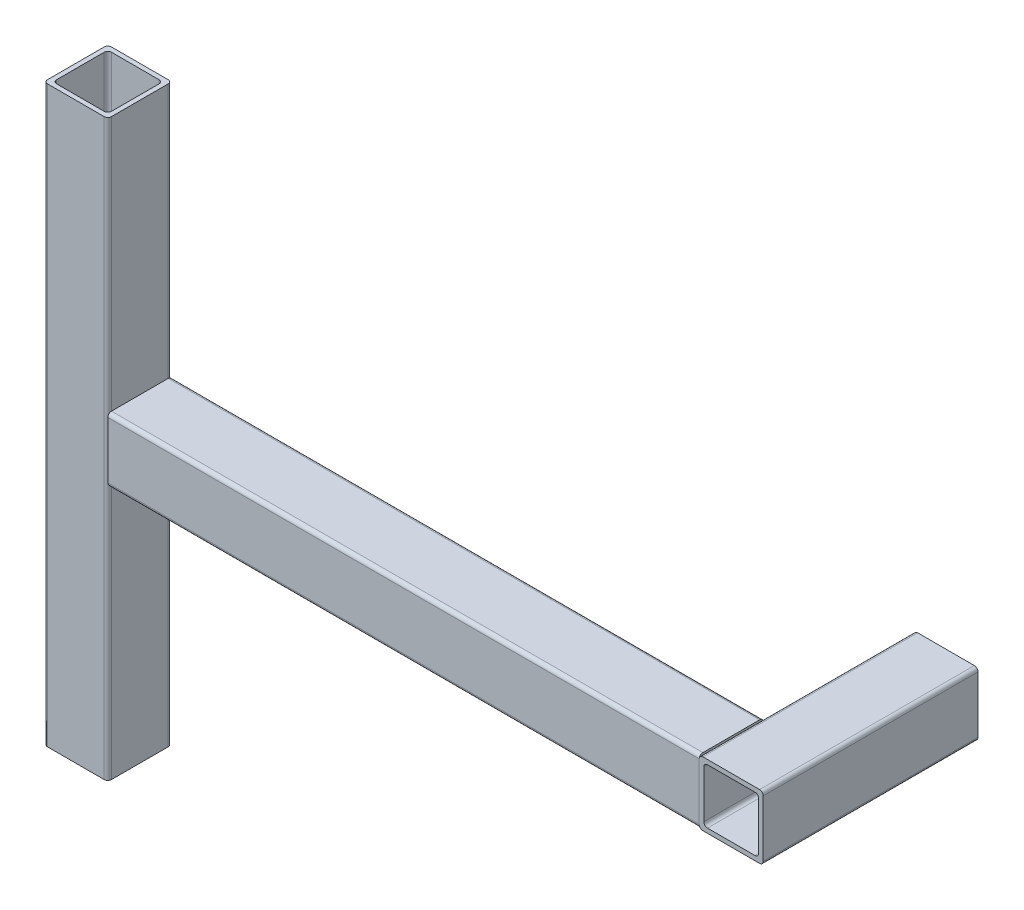
from build123d import *

# Parameters (mm, degrees)
CUSTOM_TUBE_CARRE_35_2_5_1_DEPTH   = 117.5
CUSTOM_TUBE_CARRE_35_2_5_1_2_DEPTH = 360.55
CUSTOM_TUBE_CARRE_35_2_5_1_3_DEPTH = 314.11


with BuildPart() as part:
    # Esquisse1 → Custom TUBE-CARRE-35-2.5(1) (new body)
    with BuildSketch(Plane.XY):
        with BuildLine():
            Line((-15.5, -17.5), (15.5, -17.5))
            ThreePointArc((15.5, -17.5), (16.914213562, -16.914213562), (17.5, -15.5))
            Line((17.5, -15.5), (17.5, 15.5))
            ThreePointArc((17.5, 15.5), (16.914213562, 16.914213562), (15.5, 17.5))
            Line((15.5, 17.5), (-15.5, 17.5))
            ThreePointArc((-15.5, 17.5), (-16.914213562, 16.914213562), (-17.5, 15.5))
            Line((-17.5, 15.5), (-17.5, -15.5))
            ThreePointArc((-17.5, -15.5), (-16.914213562, -16.914213562), (-15.5, -17.5))
        make_face()
        with BuildLine():
            Line((-13, -15), (13, -15))
            ThreePointArc((13, -15), (14.414213562, -14.414213562), (15, -13))
            Line((15, -13), (15, 13))
            ThreePointArc((15, 13), (14.414213562, 14.414213562), (13, 15))
            Line((13, 15), (-13, 15))
            ThreePointArc((-13, 15), (-14.414213562, 14.414213562), (-15, 13))
            Line((-15, 13), (-15, -13))
            ThreePointArc((-15, -13), (-14.414213562, -14.414213562), (-13, -15))
        make_face(mode=Mode.SUBTRACT)
    extrude(amount=CUSTOM_TUBE_CARRE_35_2_5_1_DEPTH)


with BuildPart() as body_2:
    # Esquisse1 on segment 2 (carried to segment 2) → Custom TUBE-CARRE-35-2.5_1 2 (new body)
    with BuildSketch(Plane(origin=(1, 0, 100), x_dir=(0, 0, 1), z_dir=(-1, 0, 0))):
        with BuildLine():
            Line((-15.5, -17.5), (15.5, -17.5))
            ThreePointArc((15.5, -17.5), (16.914213562, -16.914213562), (17.5, -15.5))
            Line((17.5, -15.5), (17.5, 15.5))
            ThreePointArc((17.5, 15.5), (16.914213562, 16.914213562), (15.5, 17.5))
            Line((15.5, 17.5), (-15.5, 17.5))
            ThreePointArc((-15.5, 17.5), (-16.914213562, 16.914213562), (-17.5, 15.5))
            Line((-17.5, 15.5), (-17.5, -15.5))
            ThreePointArc((-17.5, -15.5), (-16.914213562, -16.914213562), (-15.5, -17.5))
        make_face()
        with BuildLine():
            Line((-13, -15), (13, -15))
            ThreePointArc((13, -15), (14.414213562, -14.414213562), (15, -13))
            Line((15, -13), (15, 13))
            ThreePointArc((15, 13), (14.414213562, 14.414213562), (13, 15))
            Line((13, 15), (-13, 15))
            ThreePointArc((-13, 15), (-14.414213562, 14.414213562), (-15, 13))
            Line((-15, 13), (-15, -13))
            ThreePointArc((-15, -13), (-14.414213562, -14.414213562), (-13, -15))
        make_face(mode=Mode.SUBTRACT)
    extrude(amount=CUSTOM_TUBE_CARRE_35_2_5_1_2_DEPTH)

    # Custom TUBE-CARRE-35-2.5_1 2 end butt 1
    split(bisect_by=Plane(origin=(-17.5, 0, 100), x_dir=(0, -1, 0), z_dir=(-1, 0, 0)), keep=Keep.TOP)

    # Custom TUBE-CARRE-35-2.5_1 2 end butt 2
    split(bisect_by=Plane(origin=(-341.05, 0, 100), x_dir=(0, 1, 0), z_dir=(1, 0, 0)), keep=Keep.TOP)


with BuildPart() as body_3:
    # Esquisse1 on segment 3 (carried to segment 3) → Custom TUBE-CARRE-35-2.5_1 3 (new body)
    with BuildSketch(Plane(origin=(-358.55, -157.055, 100), x_dir=(1, 0, 0), z_dir=(0, 1, 0))):
        with BuildLine():
            Line((-15.5, -17.5), (15.5, -17.5))
            ThreePointArc((15.5, -17.5), (16.914213562, -16.914213562), (17.5, -15.5))
            Line((17.5, -15.5), (17.5, 15.5))
            ThreePointArc((17.5, 15.5), (16.914213562, 16.914213562), (15.5, 17.5))
            Line((15.5, 17.5), (-15.5, 17.5))
            ThreePointArc((-15.5, 17.5), (-16.914213562, 16.914213562), (-17.5, 15.5))
            Line((-17.5, 15.5), (-17.5, -15.5))
            ThreePointArc((-17.5, -15.5), (-16.914213562, -16.914213562), (-15.5, -17.5))
        make_face()
        with BuildLine():
            Line((-13, -15), (13, -15))
            ThreePointArc((13, -15), (14.414213562, -14.414213562), (15, -13))
            Line((15, -13), (15, 13))
            ThreePointArc((15, 13), (14.414213562, 14.414213562), (13, 15))
            Line((13, 15), (-13, 15))
            ThreePointArc((-13, 15), (-14.414213562, 14.414213562), (-15, 13))
            Line((-15, 13), (-15, -13))
            ThreePointArc((-15, -13), (-14.414213562, -14.414213562), (-13, -15))
        make_face(mode=Mode.SUBTRACT)
    extrude(amount=CUSTOM_TUBE_CARRE_35_2_5_1_3_DEPTH)


solid = Compound([part.part, body_2.part, body_3.part])
